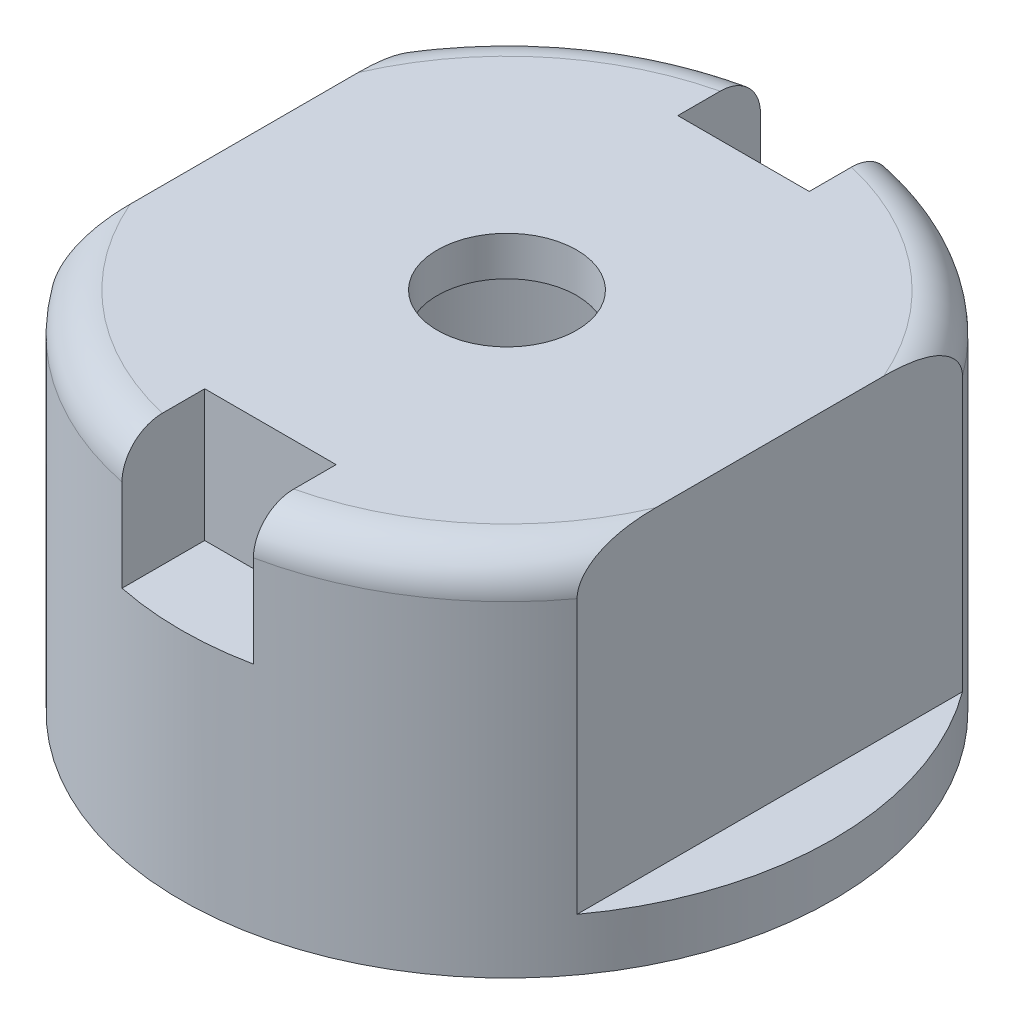
from build123d import *

# Parameters (mm, degrees)
ENL_V_START                                   = -11.9
ENL_V_MAT_EXTRU_1_DEPTH                       = 11.9
ENL_V_START_2                                 = -5
ENL_V_MAT_EXTRU_2_DEPTH                       = 5
TROU_POUR_TARAUDAGE_POUR_TROU_TARAUD_M2_D     = 1.6
TROU_POUR_TARAUDAGE_POUR_TROU_TARAUD_M2_DEPTH = 8
TROU_POUR_TARAUDAGE_POUR_TROU_TARAUD_M2_TIP   = 0.480688495


with BuildPart() as part:
    # Esquisse1 → Révolution1 (revolve)
    with BuildSketch(Plane.XY, mode=Mode.PRIVATE) as r_volution1_sk:
        with BuildLine():
            Line((-8.4, 0), (-8.4, 11.4))
            ThreePointArc((-8.4, 11.4), (-8.107106781, 12.107106781), (-7.4, 12.4))
            Line((-7.4, 12.4), (-2.65, 12.4))
            Line((-2.65, 12.4), (-2.65, 13.9))
            Line((-2.65, 13.9), (-10.9, 13.9))
            ThreePointArc((-10.9, 13.9), (-11.960660172, 13.460660172), (-12.4, 12.4))
            Line((-12.4, 12.4), (-12.4, 0))
            Line((-12.4, 0), (-8.4, 0))
        make_face()
    revolve(r_volution1_sk.sketch.rotate(Axis((0, -3.661760917, 0), (0, 1, 0)), 270), axis=Axis((0, -3.661760917, 0), (0, 1, 0)))

    # Esquisse2 → Enlèv. mat.-Extru.1 (cut)
    with BuildSketch(Plane(origin=(0, 13.9, 0), x_dir=(1, 0, 0), z_dir=(0, 1, 0)).offset(ENL_V_START)):
        with BuildLine():
            Line((-10, 7.332121112), (-10, -7.332121112))
            ThreePointArc((-10, -7.332121112), (-12.4, 0), (-10, 7.332121112))
        make_face()
        with BuildLine():
            Line((10, 7.332121112), (10, -7.332121112))
            ThreePointArc((10, -7.332121112), (12.4, 0), (10, 7.332121112))
        make_face()
    extrude(amount=ENL_V_MAT_EXTRU_1_DEPTH, mode=Mode.SUBTRACT)

    # Esquisse3 → Enlèv. mat.-Extru.2 (cut)
    with BuildSketch(Plane(origin=(0, 13.9, 0), x_dir=(1, 0, 0), z_dir=(0, 1, 0)).offset(ENL_V_START_2)):
        with BuildLine():
            Line((-2.5, 9), (2.5, 9))
            Line((2.5, 9), (2.5, 12.145369488))
            ThreePointArc((2.5, 12.145369488), (0, 12.4), (-2.5, 12.145369488))
            Line((-2.5, 12.145369488), (-2.5, 9))
        make_face()
        with BuildLine():
            Line((2.5, -12.145369488), (2.5, -9))
            Line((2.5, -9), (-2.5, -9))
            Line((-2.5, -9), (-2.5, -12.145369488))
            ThreePointArc((-2.5, -12.145369488), (0, -12.4), (2.5, -12.145369488))
        make_face()
    extrude(amount=ENL_V_MAT_EXTRU_2_DEPTH, mode=Mode.SUBTRACT)

    # Trou pour taraudage pour trou taraudé M21
    with Locations(Plane(origin=(0, 0, 0), x_dir=(-1, 0, 0), z_dir=(0, -1, 0))):
        with Locations((-3.101869381, -10.034485853), (9.030088198, -5.363767998), (3.101869381, 10.034485853), (-9.030088198, 5.363767998)):
            Hole(TROU_POUR_TARAUDAGE_POUR_TROU_TARAUD_M2_D / 2, depth=TROU_POUR_TARAUDAGE_POUR_TROU_TARAUD_M2_DEPTH)
            with Locations((0, 0, -(TROU_POUR_TARAUDAGE_POUR_TROU_TARAUD_M2_DEPTH + TROU_POUR_TARAUDAGE_POUR_TROU_TARAUD_M2_TIP / 2))):  # 118° drill point
                Cone(0, TROU_POUR_TARAUDAGE_POUR_TROU_TARAUD_M2_D / 2, TROU_POUR_TARAUDAGE_POUR_TROU_TARAUD_M2_TIP, mode=Mode.SUBTRACT)


solid = part.part
